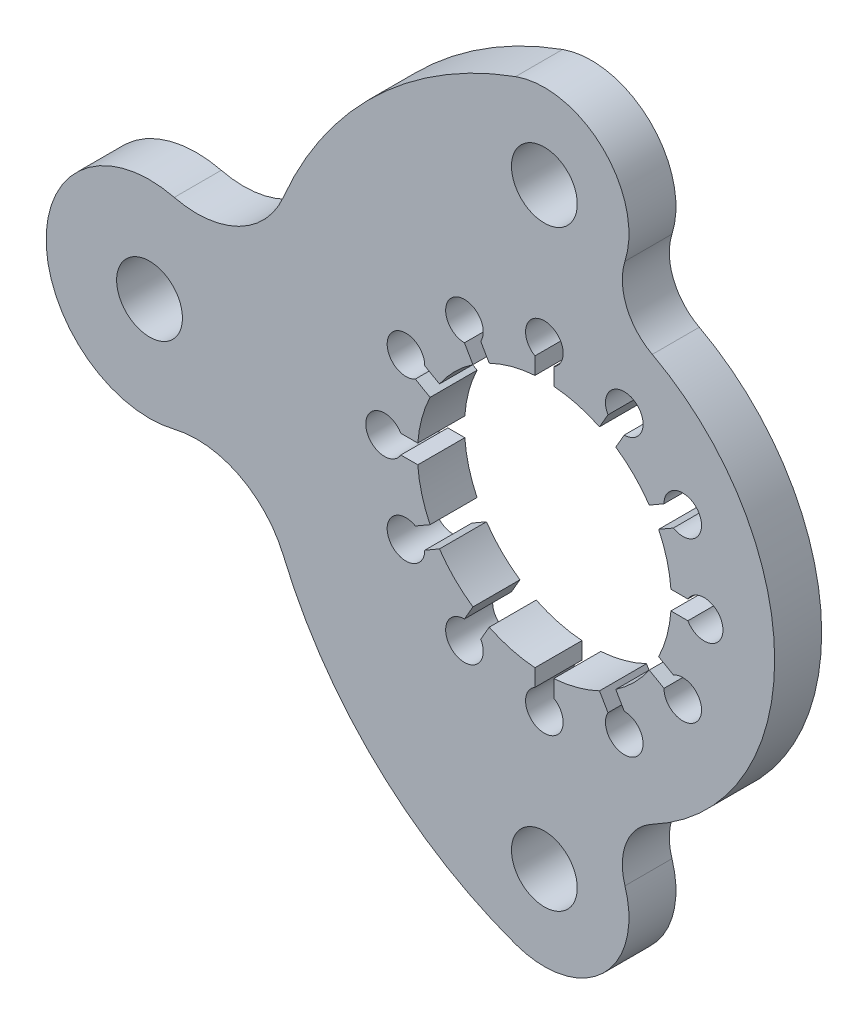
from build123d import *

# Parameters (mm, degrees)
CROQUIS1_R              = 49
CROQUIS1_R_2            = 7
SALIENTE_EXTRUIR1_DEPTH = 10


with BuildPart() as part:
    # Croquis1 → Saliente-Extruir1 (new body)
    # profile 1 of 3: a face of its own
    with BuildSketch(Plane.XY):
        Circle(CROQUIS1_R)
        with BuildLine():
            ThreePointArc((11.73086121, 24.318447633), (6.988114218, 26.07999731), (2, 26.925824036))
            Line((2, 26.925824036), (2, 30.535898385))
            ThreePointArc((2, 30.535898385), (0, 38), (-2, 30.535898385))
            Line((-2, 30.535898385), (-2, 26.925824036))
            ThreePointArc((-2, 26.925824036), (-6.988114218, 26.07999731), (-11.73086121, 24.318447633))
            Line((-11.73086121, 24.318447633), (-13.535898385, 27.444863729))
            ThreePointArc((-13.535898385, 27.444863729), (-19, 32.908965344), (-17, 25.444863729))
            Line((-17, 25.444863729), (-15.194962825, 22.318447633))
            ThreePointArc((-15.194962825, 22.318447633), (-19.091883092, 19.091883092), (-22.318447633, 15.194962825))
            Line((-22.318447633, 15.194962825), (-25.444863729, 17))
            ThreePointArc((-25.444863729, 17), (-32.908965344, 19), (-27.444863729, 13.535898385))
            Line((-27.444863729, 13.535898385), (-24.318447633, 11.73086121))
            ThreePointArc((-24.318447633, 11.73086121), (-26.07999731, 6.988114218), (-26.925824036, 2))
            Line((-26.925824036, 2), (-30.535898385, 2))
            ThreePointArc((-30.535898385, 2), (-38, 0), (-30.535898385, -2))
            Line((-30.535898385, -2), (-26.925824036, -2))
            ThreePointArc((-26.925824036, -2), (-26.07999731, -6.988114218), (-24.318447633, -11.73086121))
            Line((-24.318447633, -11.73086121), (-27.444863729, -13.535898385))
            ThreePointArc((-27.444863729, -13.535898385), (-32.908965344, -19), (-25.444863729, -17))
            Line((-25.444863729, -17), (-22.318447633, -15.194962825))
            ThreePointArc((-22.318447633, -15.194962825), (-19.091883092, -19.091883092), (-15.194962825, -22.318447633))
            Line((-15.194962825, -22.318447633), (-17, -25.444863729))
            ThreePointArc((-17, -25.444863729), (-19, -32.908965344), (-13.535898385, -27.444863729))
            Line((-13.535898385, -27.444863729), (-11.73086121, -24.318447633))
            ThreePointArc((-11.73086121, -24.318447633), (-6.988114218, -26.07999731), (-2, -26.925824036))
            Line((-2, -26.925824036), (-2, -30.535898385))
            ThreePointArc((-2, -30.535898385), (0, -38), (2, -30.535898385))
            Line((2, -30.535898385), (2, -26.925824036))
            ThreePointArc((2, -26.925824036), (6.988114218, -26.07999731), (11.73086121, -24.318447633))
            Line((11.73086121, -24.318447633), (13.535898385, -27.444863729))
            ThreePointArc((13.535898385, -27.444863729), (19, -32.908965344), (17, -25.444863729))
            Line((17, -25.444863729), (15.194962825, -22.318447633))
            ThreePointArc((15.194962825, -22.318447633), (19.091883092, -19.091883092), (22.318447633, -15.194962825))
            Line((22.318447633, -15.194962825), (25.444863729, -17))
            ThreePointArc((25.444863729, -17), (32.908965344, -19), (27.444863729, -13.535898385))
            Line((27.444863729, -13.535898385), (24.318447633, -11.73086121))
            ThreePointArc((24.318447633, -11.73086121), (26.07999731, -6.988114218), (26.925824036, -2))
            Line((26.925824036, -2), (30.535898385, -2))
            ThreePointArc((30.535898385, -2), (38, 0), (30.535898385, 2))
            Line((30.535898385, 2), (26.925824036, 2))
            ThreePointArc((26.925824036, 2), (26.07999731, 6.988114218), (24.318447633, 11.73086121))
            Line((24.318447633, 11.73086121), (27.444863729, 13.535898385))
            ThreePointArc((27.444863729, 13.535898385), (32.908965344, 19), (25.444863729, 17))
            Line((25.444863729, 17), (22.318447633, 15.194962825))
            ThreePointArc((22.318447633, 15.194962825), (19.091883092, 19.091883092), (15.194962825, 22.318447633))
            Line((15.194962825, 22.318447633), (17, 25.444863729))
            ThreePointArc((17, 25.444863729), (19, 32.908965344), (13.535898385, 27.444863729))
            Line((13.535898385, 27.444863729), (11.73086121, 24.318447633))
        make_face(mode=Mode.SUBTRACT)
    # profile 2 of 3: a face of its own
    with BuildSketch(Plane.XY):
        with BuildLine():
            ThreePointArc((22.960111456, -43.287795993), (-49, 0), (22.960111456, 43.287795993))
            ThreePointArc((22.960111456, 43.287795993), (17.471680778, 49.356927241), (17.149797537, 57.533333333))
            ThreePointArc((17.149797537, 57.533333333), (12.479188654, 75.97188693), (-6.126315717, 79.925373134))
            ThreePointArc((-6.126315717, 79.925373134), (-35.730309716, 61.63434209), (-55.523644659, 33.012983471))
            ThreePointArc((-55.523644659, 33.012983471), (-62.196491498, 0), (-55.523644659, -33.012983471))
            ThreePointArc((-55.523644659, -33.012983471), (-35.730309716, -61.63434209), (-6.126315717, -79.925373134))
            ThreePointArc((-6.126315717, -79.925373134), (12.479188654, -75.97188693), (17.149797537, -57.533333333))
            ThreePointArc((17.149797537, -57.533333333), (17.471680778, -49.356927241), (22.960111456, -43.287795993))
        make_face()
        with Locations((0, -63)):
            Circle(CROQUIS1_R_2, mode=Mode.SUBTRACT)
        with Locations((0, 63)):
            Circle(CROQUIS1_R_2, mode=Mode.SUBTRACT)
    # profile 3 of 3: a face of its own
    with BuildSketch(Plane.XY):
        with BuildLine():
            ThreePointArc((-55.523644659, -33.012983471), (-62.196491498, 0), (-55.523644659, 33.012983471))
            ThreePointArc((-55.523644659, 33.012983471), (-64.981782963, 22.905981014), (-78.737580645, 21.361342246))
            ThreePointArc((-78.737580645, 21.361342246), (-106, 0), (-78.737580645, -21.361342246))
            ThreePointArc((-78.737580645, -21.361342246), (-64.981782963, -22.905981014), (-55.523644659, -33.012983471))
        make_face()
        with Locations((-84, 0)):
            Circle(CROQUIS1_R_2, mode=Mode.SUBTRACT)
    extrude(amount=SALIENTE_EXTRUIR1_DEPTH)


solid = part.part
